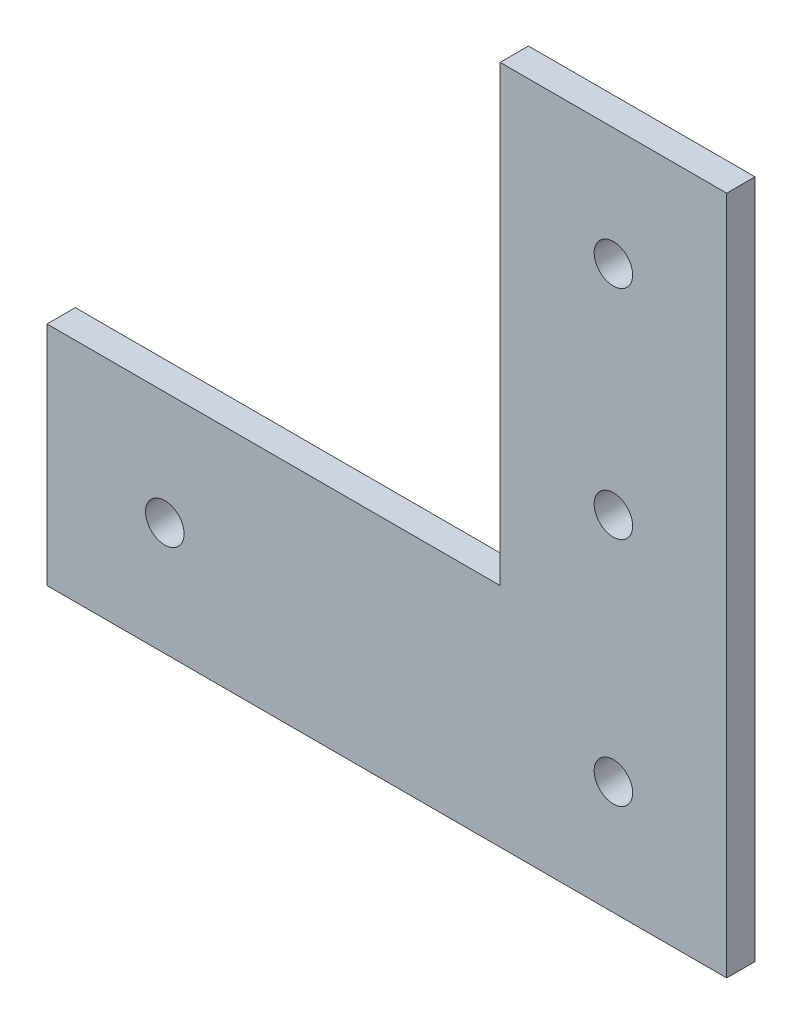
from build123d import *

# Parameters (mm, degrees)
SKETCH1_W           = 76.2
SKETCH1_H           = 76.2
BOSS_EXTRUDE1_DEPTH = 3.175
SKETCH2_W           = 50.8
SKETCH2_H           = 50.8
CUT_EXTRUDE1_DEPTH  = 6.35
SKETCH3_R           = 2.159
CUT_EXTRUDE2_DEPTH  = 6.35
SKETCH5_R           = 2.159
CUT_EXTRUDE3_DEPTH  = 6.35
SKETCH6_R           = 2.159
CUT_EXTRUDE4_DEPTH  = 54.975


with BuildPart() as part:
    # Sketch1 → Boss-Extrude1 (new body)
    with BuildSketch(Plane.XY):
        Rectangle(SKETCH1_W, SKETCH1_H)
    extrude(amount=BOSS_EXTRUDE1_DEPTH)

    # Sketch2 → Cut-Extrude1 (cut)
    with BuildSketch(Plane(origin=(0, 0, 0), x_dir=(-1, 0, 0), z_dir=(0, 0, -1))):
        with Locations((12.7, 12.7)):
            Rectangle(SKETCH2_W, SKETCH2_H)
    extrude(amount=-CUT_EXTRUDE1_DEPTH, mode=Mode.SUBTRACT)

    # Sketch3 → Cut-Extrude2 (cut)
    with BuildSketch(Plane(origin=(0, 0, 0), x_dir=(-1, 0, 0), z_dir=(0, 0, -1))):
        with Locations((-25.4, -25.4)):
            Circle(SKETCH3_R)
    extrude(amount=-CUT_EXTRUDE2_DEPTH, mode=Mode.SUBTRACT)

    # Sketch5 → Cut-Extrude3 (cut)
    with BuildSketch(Plane(origin=(0, 0, 0), x_dir=(-1, 0, 0), z_dir=(0, 0, -1))):
        with Locations((24.892, -25.4)):
            Circle(SKETCH5_R)
    extrude(amount=-CUT_EXTRUDE3_DEPTH, mode=Mode.SUBTRACT)

    # Sketch6 → Cut-Extrude4 (cut, through all)
    with BuildSketch(Plane.XY.offset(3.175)):
        with Locations((25.4, 0.508)):
            Circle(SKETCH6_R)
        with Locations((25.4, 24.892)):
            Circle(SKETCH6_R)
    extrude(amount=-CUT_EXTRUDE4_DEPTH, mode=Mode.SUBTRACT)


solid = part.part
